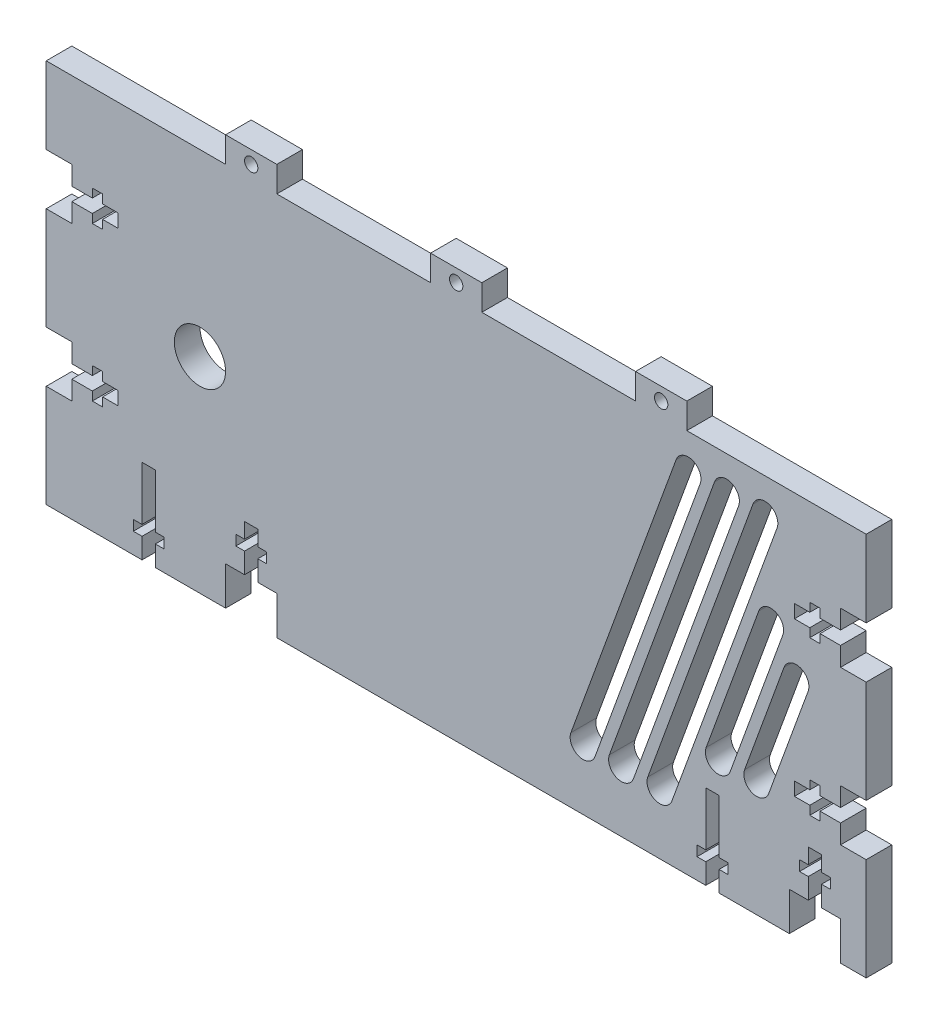
from build123d import *

# Parameters (mm, degrees)
SKETCH1_W            = 203.2
SKETCH1_H            = 101.6
BOSS_EXTRUDE1_DEPTH  = 6.35
CUT_EXTRUDE2_DEPTH   = 114.769602707
MIRROR1_COPY_1_DEPTH = 114.769602707
SKETCH2_R            = 1.651
SKETCH2_W            = 44.45
SKETCH2_H            = 6.35
SKETCH2_W_2          = 38.1
CUT_EXTRUDE1_DEPTH   = 114.769602707
SKETCH4_R            = 6.35
CUT_EXTRUDE3_DEPTH   = 114.769602707
CUT_EXTRUDE4_DEPTH   = 114.769602707
LPATTERN1_COUNT      = 3
LPATTERN1_PITCH      = 9.525
CUT_EXTRUDE5_DEPTH   = 114.769602707


with BuildPart() as part:
    # Sketch1 → Boss-Extrude1 (new body)
    with BuildSketch(Plane.XY):
        Rectangle(SKETCH1_W, SKETCH1_H)
    extrude(amount=BOSS_EXTRUDE1_DEPTH)

    # Sketch3 → Cut-Extrude2 (cut, through all)
    with BuildSketch(Plane.XY.offset(6.35)):
        Polygon((101.6, 25.4), (95.25, 25.4), (95.25, 20.701), (90.17, 20.701), (90.17, 22.86), (87.63, 22.86), (87.63, 20.701), (83.82, 20.701), (83.82, 17.399), (87.63, 17.399), (87.63, 15.24), (90.17, 15.24), (90.17, 17.399), (95.25, 17.399), (95.25, 12.7), (101.6, 12.7), align=None)
    cut_extrude2 = extrude(amount=-CUT_EXTRUDE2_DEPTH, mode=Mode.SUBTRACT)

    # Mirror4: Cut-Extrude2 across plane
    add(cut_extrude2.mirror(Plane.ZX), mode=Mode.SUBTRACT)

    # Mirror1: Cut-Extrude2 across plane
    add(cut_extrude2.mirror(Plane(origin=(0, 0, 0), x_dir=(0, 0, 1), z_dir=(1, 0, 0))), mode=Mode.SUBTRACT)

    # Mirror1 copy 1 sketch → Mirror1 copy 1 (cut, through all)
    with BuildSketch(Plane(origin=(0, 0, 6.35), x_dir=(-1, 0, 0), z_dir=(0, 0, 1))):
        Polygon((101.6, 25.4), (95.25, 25.4), (95.25, 20.701), (90.17, 20.701), (90.17, 22.86), (87.63, 22.86), (87.63, 20.701), (83.82, 20.701), (83.82, 17.399), (87.63, 17.399), (87.63, 15.24), (90.17, 15.24), (90.17, 17.399), (95.25, 17.399), (95.25, 12.7), (101.6, 12.7), align=None)
    extrude(amount=-MIRROR1_COPY_1_DEPTH, mode=Mode.SUBTRACT)

    # Sketch2 → Cut-Extrude1 (cut, through all)
    with BuildSketch(Plane.XY.offset(6.35)):
        with Locations((-50.8, 47.625)):
            Circle(SKETCH2_R)
        with Locations((0, 47.625)):
            Circle(SKETCH2_R)
        with Locations((50.8, 47.625)):
            Circle(SKETCH2_R)
        with Locations((-79.375, 47.625)):
            Rectangle(SKETCH2_W, SKETCH2_H)
        with Locations((-25.4, 47.625)):
            Rectangle(SKETCH2_W_2, SKETCH2_H)
        with Locations((25.4, 47.625)):
            Rectangle(SKETCH2_W_2, SKETCH2_H)
        with Locations((79.375, 47.625)):
            Rectangle(SKETCH2_W, SKETCH2_H)
        Polygon((-57.15, -50.8), (-57.15, -41.275), (-52.451, -41.275), (-52.451, -36.195), (-54.61, -36.195), (-54.61, -33.655), (-52.451, -33.655), (-52.451, -29.845), (-49.149, -29.845), (-49.149, -33.655), (-46.99, -33.655), (-46.99, -36.195), (-49.149, -36.195), (-49.149, -41.275), (-44.45, -41.275), (-44.45, -50.8), align=None)
        Polygon((82.55, -50.8), (82.55, -41.275), (87.249, -41.275), (87.249, -36.195), (85.09, -36.195), (85.09, -33.655), (87.249, -33.655), (87.249, -29.845), (90.551, -29.845), (90.551, -33.655), (92.71, -33.655), (92.71, -36.195), (90.551, -36.195), (90.551, -41.275), (95.25, -41.275), (95.25, -50.8), align=None)
        Polygon((61.849, -29.845), (65.151, -29.845), (65.151, -43.18), (67.31, -43.18), (67.31, -45.72), (65.151, -45.72), (65.151, -50.8), (61.849, -50.8), (61.849, -45.72), (59.69, -45.72), (59.69, -43.18), (61.849, -43.18), align=None)
        Polygon((-77.851, -50.8), (-77.851, -45.72), (-80.01, -45.72), (-80.01, -43.18), (-77.851, -43.18), (-77.851, -29.845), (-74.549, -29.845), (-74.549, -43.18), (-72.39, -43.18), (-72.39, -45.72), (-74.549, -45.72), (-74.549, -50.8), align=None)
    extrude(amount=-CUT_EXTRUDE1_DEPTH, mode=Mode.SUBTRACT)

    # Sketch4 → Cut-Extrude3 (cut, through all)
    with BuildSketch(Plane.XY.offset(6.35)):
        with Locations((-63.5, 0)):
            Circle(SKETCH4_R)
    extrude(amount=-CUT_EXTRUDE3_DEPTH, mode=Mode.SUBTRACT)

    # Sketch5 → Cut-Extrude4 (cut, through all)
    with BuildSketch(Plane.XY.offset(6.35)):
        with BuildLine():
            Line((47.485508468, -34.716374897), (73.54744339, 36.888202807))
            ThreePointArc((73.54744339, 36.888202807), (77.616881416, 38.785812923), (79.514491532, 34.716374897))
            Line((79.514491532, 34.716374897), (53.45255661, -36.888202807))
            ThreePointArc((53.45255661, -36.888202807), (49.383118584, -38.785812923), (47.485508468, -34.716374897))
        make_face()
    cut_extrude4 = extrude(amount=-CUT_EXTRUDE4_DEPTH, mode=Mode.SUBTRACT)

    # LPattern1: Cut-Extrude4 ×3
    with Locations(*[(-i * LPATTERN1_PITCH, 0, 0) for i in range(1, LPATTERN1_COUNT)]):
        add(cut_extrude4, mode=Mode.SUBTRACT)

    # Sketch6 → Cut-Extrude5 (cut, through all)
    with BuildSketch(Plane.XY.offset(6.35)):
        with BuildLine():
            Line((61.952237472, -21.139086045), (74.983204933, 14.663202807))
            ThreePointArc((74.983204933, 14.663202807), (79.052642959, 16.560812923), (80.950253075, 12.491374897))
            Line((80.950253075, 12.491374897), (67.919285614, -23.310913955))
            ThreePointArc((67.919285614, -23.310913955), (63.849847588, -25.208524071), (61.952237472, -21.139086045))
        make_face()
        with BuildLine():
            Line((87.21751121, 3.540802684), (77.444285614, -23.310913955))
            ThreePointArc((77.444285614, -23.310913955), (73.374847588, -25.208524071), (71.477237472, -21.139086045))
            Line((71.477237472, -21.139086045), (81.250463068, 5.712630594))
            ThreePointArc((81.250463068, 5.712630594), (85.319901094, 7.61024071), (87.21751121, 3.540802684))
        make_face()
    extrude(amount=-CUT_EXTRUDE5_DEPTH, mode=Mode.SUBTRACT)


solid = part.part
